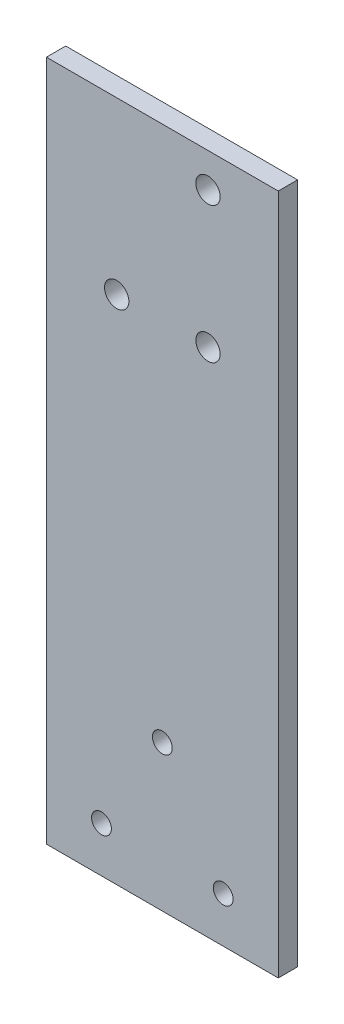
from build123d import *

# Parameters (mm, degrees)
SKETCH1_W           = 76.2
SKETCH1_H           = 224
SKETCH1_R           = 4
SKETCH1_R_2         = 3.25
BOSS_EXTRUDE1_DEPTH = 6.35


with BuildPart() as part:
    # Sketch1 → Boss-Extrude1 (new body)
    with BuildSketch(Plane.XY):
        with Locations((38.1, 112)):
            Rectangle(SKETCH1_W, SKETCH1_H)
        with Locations((23.1, 168)):
            Circle(SKETCH1_R, mode=Mode.SUBTRACT)
        with Locations((53.1, 168)):
            Circle(SKETCH1_R, mode=Mode.SUBTRACT)
        with Locations((58.1, 15)):
            Circle(SKETCH1_R_2, mode=Mode.SUBTRACT)
        with Locations((18.1, 15)):
            Circle(SKETCH1_R_2, mode=Mode.SUBTRACT)
        with Locations((53.1, 212.75)):
            Circle(SKETCH1_R, mode=Mode.SUBTRACT)
        with Locations((38.1, 48)):
            Circle(SKETCH1_R_2, mode=Mode.SUBTRACT)
    extrude(amount=BOSS_EXTRUDE1_DEPTH)


solid = part.part
